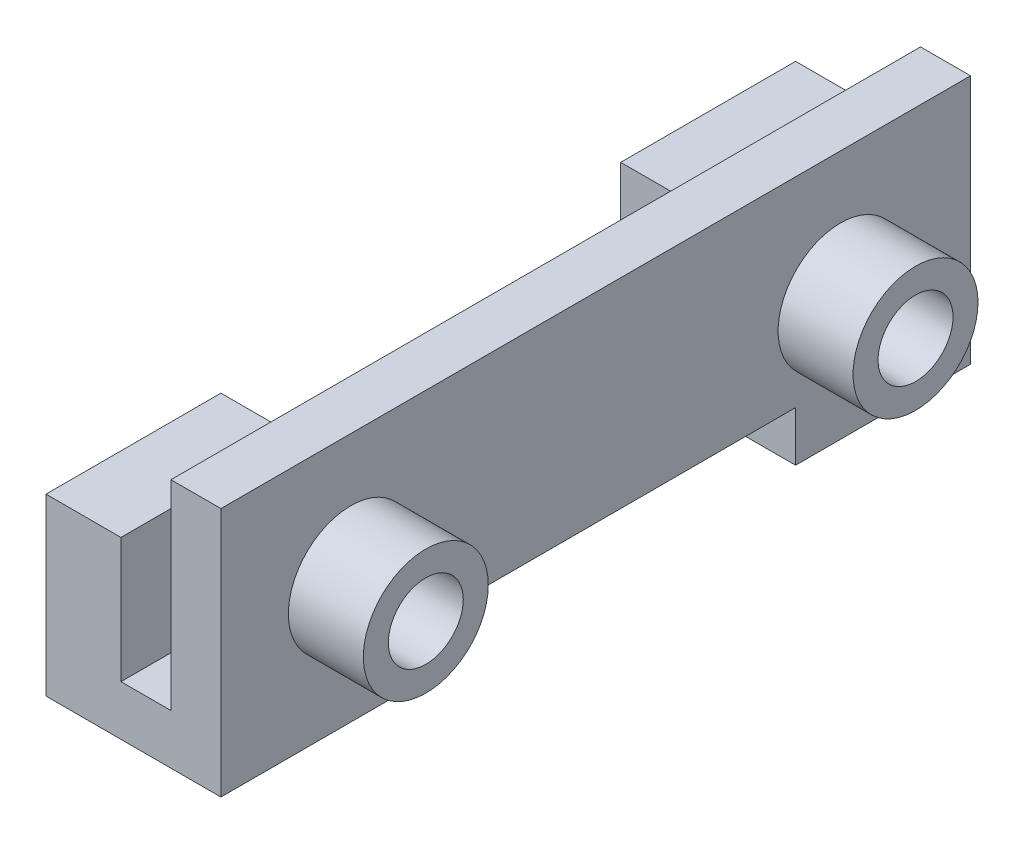
from build123d import *

# Parameters (mm, degrees)
ESQUISSE1_W             = 30
ESQUISSE1_H             = 10
BOSS_EXTRU_1_DEPTH      = 2
ESQUISSE2_R             = 2.5
BOSS_EXTRU_2_DEPTH      = 3
ESQUISSE3_R             = 1.5
ENL_V_MAT_EXTRU_1_DEPTH = 17.583123952
ESQUISSE4_R             = 1.5
ENL_V_MAT_EXTRU_2_DEPTH = 17.583123952
ESQUISSE7_W             = 2
ESQUISSE7_H             = 8
ENL_V_MAT_EXTRU_3_DEPTH = 2
ESQUISSE8_W             = 7
ESQUISSE8_H             = 2
BOSS_EXTRU_3_DEPTH      = 5
ESQUISSE12_W            = 3
ESQUISSE12_H            = 7
BOSS_EXTRU_4_DEPTH      = 5


with BuildPart() as part:
    # Esquisse1 → Boss.-Extru.1 (new body)
    with BuildSketch(Plane(origin=(0, 0, 0), x_dir=(0, 0, -1), z_dir=(1, 0, 0))):
        Rectangle(ESQUISSE1_W, ESQUISSE1_H)
    extrude(amount=BOSS_EXTRU_1_DEPTH)

    # Esquisse2 → Boss.-Extru.2 (add)
    with BuildSketch(Plane(origin=(2, 0, 0), x_dir=(0, 0, -1), z_dir=(1, 0, 0))):
        with Locations((-9.8, 0)):
            Circle(ESQUISSE2_R)
        with Locations((9.8, 0)):
            Circle(ESQUISSE2_R)
    extrude(amount=BOSS_EXTRU_2_DEPTH)

    # Esquisse3 → Enlèv. mat.-Extru.1 (cut, through all)
    with BuildSketch(Plane(origin=(5, 0, 0), x_dir=(0, 0, -1), z_dir=(1, 0, 0))):
        with Locations((-9.8, 0)):
            Circle(ESQUISSE3_R)
    extrude(amount=-ENL_V_MAT_EXTRU_1_DEPTH, mode=Mode.SUBTRACT)

    # Esquisse4 → Enlèv. mat.-Extru.2 (cut, through all)
    with BuildSketch(Plane(origin=(5, 0, 0), x_dir=(0, 0, -1), z_dir=(1, 0, 0))):
        with Locations((9.8, 0)):
            Circle(ESQUISSE4_R)
    extrude(amount=-ENL_V_MAT_EXTRU_2_DEPTH, mode=Mode.SUBTRACT)

    # Esquisse7 → Enlèv. mat.-Extru.3 (cut)
    with BuildSketch(Plane.XZ.offset(5)):
        with Locations((1, 4)):
            Rectangle(ESQUISSE7_W, ESQUISSE7_H)
    enl_v_mat_extru_3 = extrude(amount=-ENL_V_MAT_EXTRU_3_DEPTH, mode=Mode.SUBTRACT)

    # Symétrie1: Enlèv. mat.-Extru.3 across plane
    add(enl_v_mat_extru_3.mirror(Plane.XY), mode=Mode.SUBTRACT)

    # Esquisse8 → Boss.-Extru.3 (add)
    with BuildSketch(Plane.ZY):
        with Locations((-11.5, -4)):
            Rectangle(ESQUISSE8_W, ESQUISSE8_H)
    boss_extru_3 = extrude(amount=BOSS_EXTRU_3_DEPTH)

    # Esquisse12 → Boss.-Extru.4 (add)
    with BuildSketch(Plane(origin=(0, -3, 0), x_dir=(1, 0, 0), z_dir=(0, 1, 0))):
        with Locations((-3.5, 11.5)):
            Rectangle(ESQUISSE12_W, ESQUISSE12_H)
    boss_extru_4 = extrude(amount=BOSS_EXTRU_4_DEPTH)

    # Symétrie2: Boss.-Extru.3, Boss.-Extru.4 across plane
    add(boss_extru_3.mirror(Plane.XY))
    add(boss_extru_4.mirror(Plane.XY))


solid = part.part
